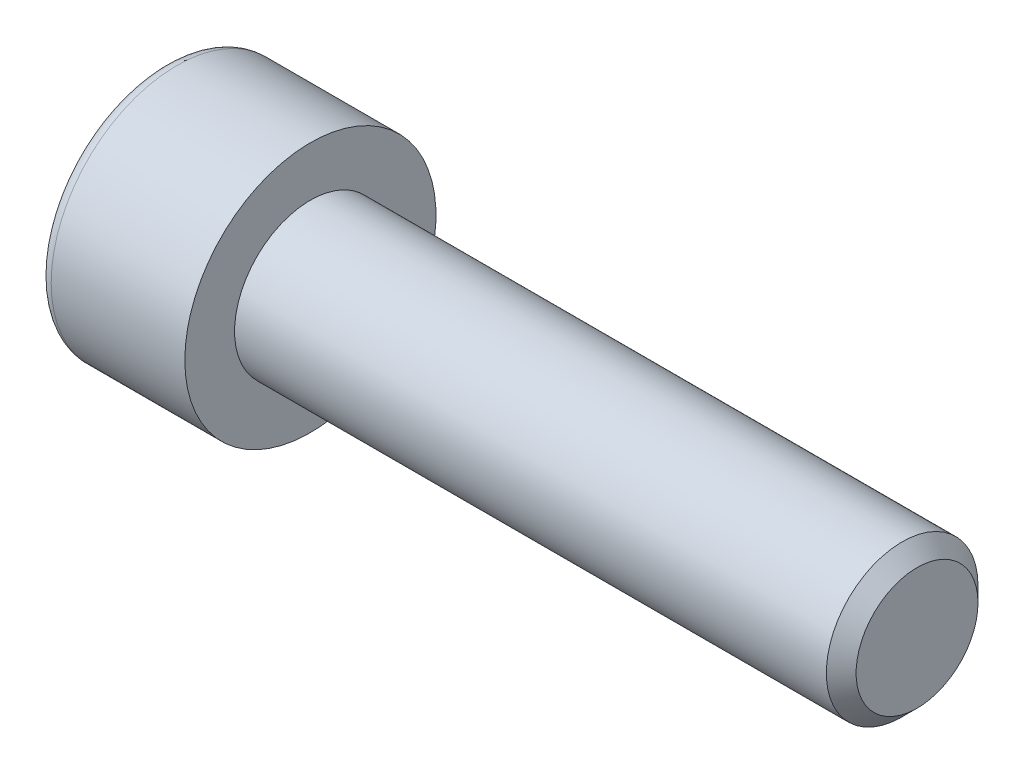
from build123d import *

# Parameters (mm, degrees)
SKETCH1_W           = 4.82
SKETCH1_H           = 4.14
SKETCH2_R           = 2.5
BOSS_EXTRUDE1_DEPTH = 20
CUT_EXTRUDE1_DEPTH  = 2.5
CHAMFER1_SIZE       = 0.4905
FILLET1_R           = 0.414


with BuildPart() as part:
    # Sketch1 → Revolve1 (revolve)
    with BuildSketch(Plane(origin=(0, 0, 0), x_dir=(-1, 0, 0), z_dir=(0, 0, -1)), mode=Mode.PRIVATE) as revolve1_sk:
        with Locations((2.41, 2.07)):
            Rectangle(SKETCH1_W, SKETCH1_H)
    revolve(revolve1_sk.sketch.rotate(Axis((0, 0, 0), (-1, 0, 0)), 270), axis=Axis((0, 0, 0), (-1, 0, 0)))

    # Sketch2 → Boss-Extrude1 (add)
    with BuildSketch(Plane(origin=(0, 0, 0), x_dir=(0, 0, -1), z_dir=(1, 0, 0))):
        Circle(SKETCH2_R)
    extrude(amount=BOSS_EXTRUDE1_DEPTH)

    # Sketch3 → Cut-Extrude1 (cut)
    with BuildSketch(Plane.ZY.offset(4.82)):
        Polygon((-2, -1.154700538), (0, -2.309401077), (2, -1.154700538), (2, 1.154700538), (0, 2.309401077), (-2, 1.154700538), align=None)
    extrude(amount=-CUT_EXTRUDE1_DEPTH, mode=Mode.SUBTRACT)

    # Chamfer1
    chamfer1_edges = [part.edges().sort_by_distance(p)[0] for p in [
        (20, 0, 2.5),
    ]]
    chamfer(chamfer1_edges, length=CHAMFER1_SIZE)

    # Fillet1
    fillet1_edges = [part.edges().sort_by_distance(p)[0] for p in [
        (-4.82, 0, -4.14),
    ]]
    fillet(fillet1_edges, radius=FILLET1_R)


solid = part.part
